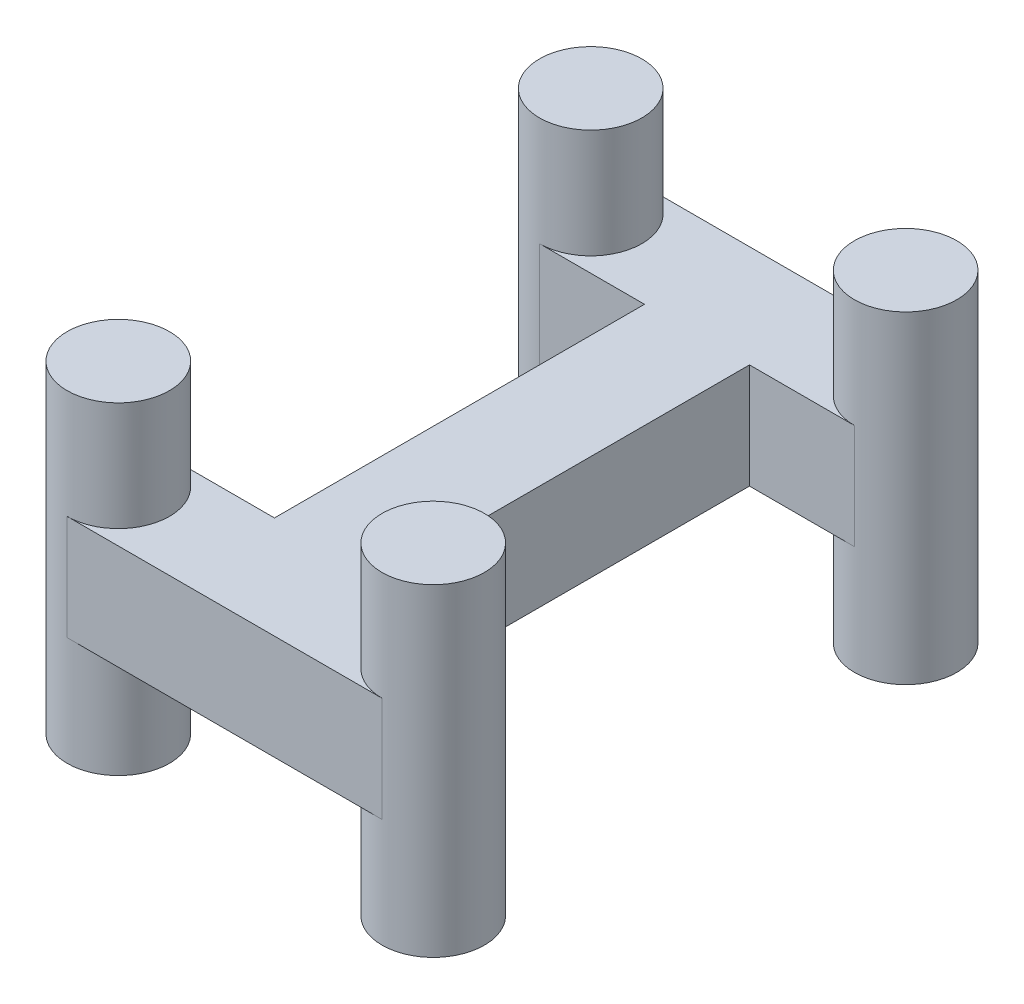
from build123d import *

# Parameters (mm, degrees)
BOSS_EXTRUDE1_DEPTH      = 2
BOSS_EXTRUDE1_DEPTH_BACK = 2
BOSS_EXTRUDE2_DEPTH      = 6.15
BOSS_EXTRUDE2_DEPTH_BACK = 6.15
SKETCH1_4_R              = 1.95


with BuildPart() as part:
    # Sketch1 → Boss-Extrude1 (new, two sides: drawn at the far end of the back side and taken through both)
    with BuildSketch(Plane(origin=(0, 0, 0), x_dir=(1, 0, 0), z_dir=(0, 1, 0)).offset(-BOSS_EXTRUDE1_DEPTH_BACK)):
        with BuildLine():
            ThreePointArc((-4.05, -9), (-4.621141777, -10.378858223), (-6, -10.95))
            Line((-6, -10.95), (6, -10.95))
            ThreePointArc((6, -10.95), (4.05, -9), (6, -7.05))
            Line((6, -7.05), (2, -7.05))
            Line((2, -7.05), (2, 7.05))
            Line((2, 7.05), (6, 7.05))
            ThreePointArc((6, 7.05), (4.05, 9), (6, 10.95))
            Line((6, 10.95), (-6, 10.95))
            ThreePointArc((-6, 10.95), (-4.621141777, 10.378858223), (-4.05, 9))
            ThreePointArc((-4.05, 9), (-4.621141777, 7.621141777), (-6, 7.05))
            Line((-6, 7.05), (-2, 7.05))
            Line((-2, 7.05), (-2, -7.05))
            Line((-2, -7.05), (-6, -7.05))
            ThreePointArc((-6, -7.05), (-4.621141777, -7.621141777), (-4.05, -9))
        make_face()
    extrude(amount=BOSS_EXTRUDE1_DEPTH + BOSS_EXTRUDE1_DEPTH_BACK)

    # Sketch1<4> → Boss-Extrude2 (add, two sides: drawn at the far end of the back side and taken through both)
    with BuildSketch(Plane(origin=(0, 0, 0), x_dir=(1, 0, 0), z_dir=(0, 1, 0)).offset(-BOSS_EXTRUDE2_DEPTH_BACK)):
        with Locations((-6, -9)):
            Circle(SKETCH1_4_R)
        with Locations((6, -9)):
            Circle(SKETCH1_4_R)
        with Locations((-6, 9)):
            Circle(SKETCH1_4_R)
        with Locations((6, 9)):
            Circle(SKETCH1_4_R)
    extrude(amount=BOSS_EXTRUDE2_DEPTH + BOSS_EXTRUDE2_DEPTH_BACK)


solid = part.part
